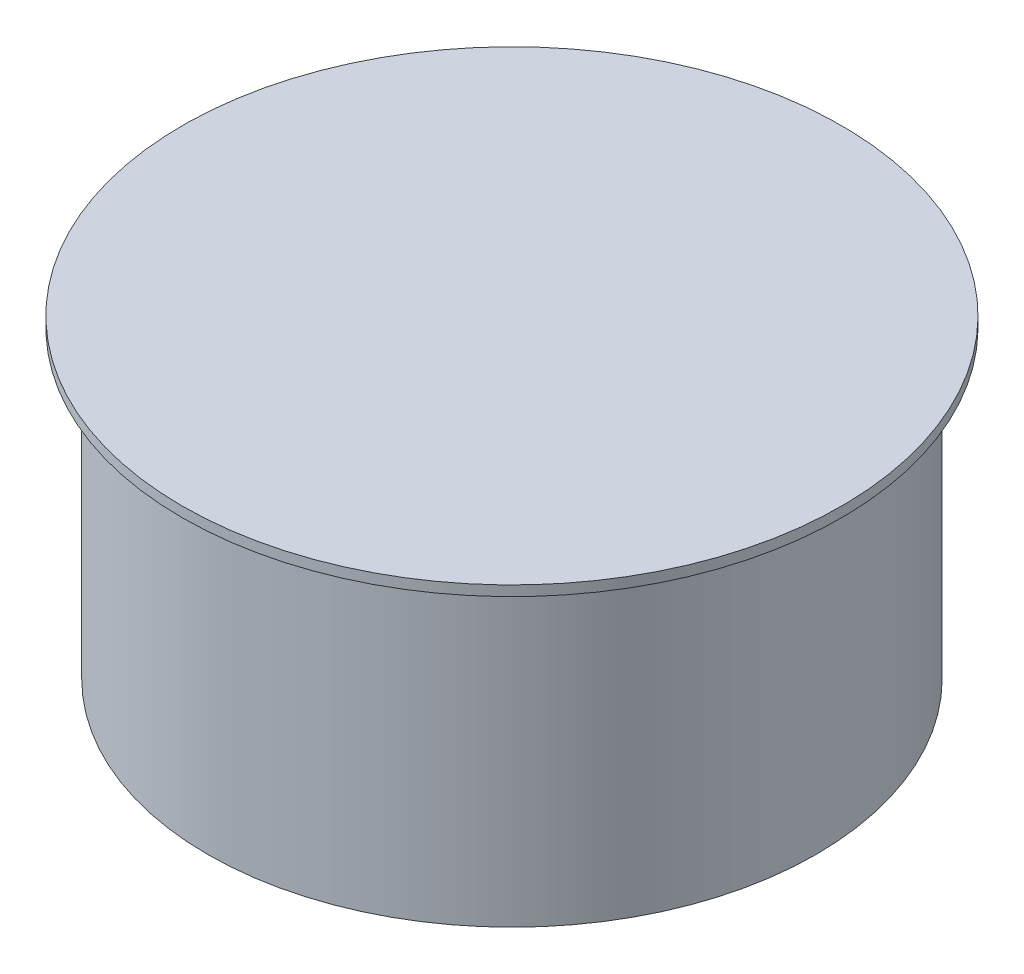
from build123d import *

# Parameters (mm, degrees)
SKETCH1_R           = 152.4
BOSS_EXTRUDE1_DEPTH = 152.4
SKETCH3_R           = 165.1
BOSS_EXTRUDE2_DEPTH = 5.08


with BuildPart() as part:
    # Sketch1 → Boss-Extrude1 (new body)
    with BuildSketch(Plane(origin=(0, 0, 0), x_dir=(1, 0, 0), z_dir=(0, 1, 0))):
        with Locations(Location((0, 0, 0), (0, 0, 90))):
            Circle(SKETCH1_R)
    extrude(amount=BOSS_EXTRUDE1_DEPTH)

    # Sketch3 → Boss-Extrude2 (add)
    with BuildSketch(Plane(origin=(0, 152.4, 0), x_dir=(1, 0, 0), z_dir=(0, 1, 0))):
        with Locations(Location((0, 0, 0), (0, 0, 270))):
            Circle(SKETCH3_R)
    extrude(amount=BOSS_EXTRUDE2_DEPTH)


solid = part.part
